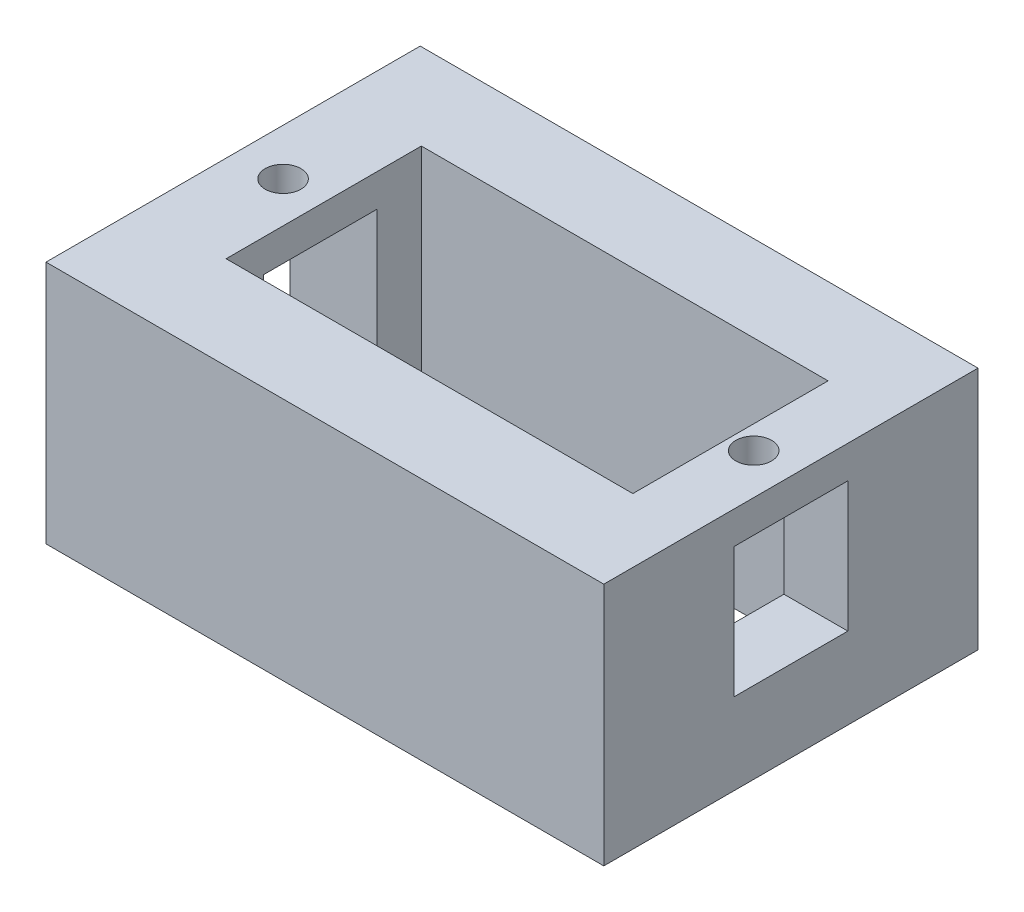
from build123d import *

# Parameters (mm, degrees)
ESQUISSE1_W             = 34.285714285
ESQUISSE1_H             = 23
ESQUISSE1_W_2           = 25
ESQUISSE1_H_2           = 12
BOSS_EXTRU_1_DEPTH      = 15
ESQUISSE2_W             = 7
ESQUISSE2_H             = 8
ENL_V_MAT_EXTRU_1_DEPTH = 60
ESQUISSE3_R             = 1.1
ENL_V_MAT_EXTRU_2_DEPTH = 10


with BuildPart() as part:
    # Esquisse1 → Boss.-Extru.1 (new body)
    with BuildSketch(Plane(origin=(0, 0, 0), x_dir=(1, 0, 0), z_dir=(0, 1, 0))):
        with Locations((5.428571429, 1.035714286)):
            Rectangle(ESQUISSE1_W, ESQUISSE1_H)
        with Locations((6.142857143, 1.25)):
            Rectangle(ESQUISSE1_W_2, ESQUISSE1_H_2, mode=Mode.SUBTRACT)
    extrude(amount=BOSS_EXTRU_1_DEPTH)

    # Esquisse2 → Enlèv. mat.-Extru.1 (cut)
    with BuildSketch(Plane.ZY.offset(11.714285714)):
        with Locations((-1.035714286, 9)):
            Rectangle(ESQUISSE2_W, ESQUISSE2_H)
    extrude(amount=-ENL_V_MAT_EXTRU_1_DEPTH, mode=Mode.SUBTRACT)

    # Esquisse3 → Enlèv. mat.-Extru.2 (cut)
    with BuildSketch(Plane(origin=(0, 15, 0), x_dir=(1, 0, 0), z_dir=(0, 1, 0))):
        with Locations(Location((-8.857142857, 1.25, 0), (0, 0, 270))):
            Circle(ESQUISSE3_R)
        with Locations(Location((20.071428571, 1.25, 0), (0, 0, 270))):
            Circle(ESQUISSE3_R)
    extrude(amount=-ENL_V_MAT_EXTRU_2_DEPTH, mode=Mode.SUBTRACT)


solid = part.part
